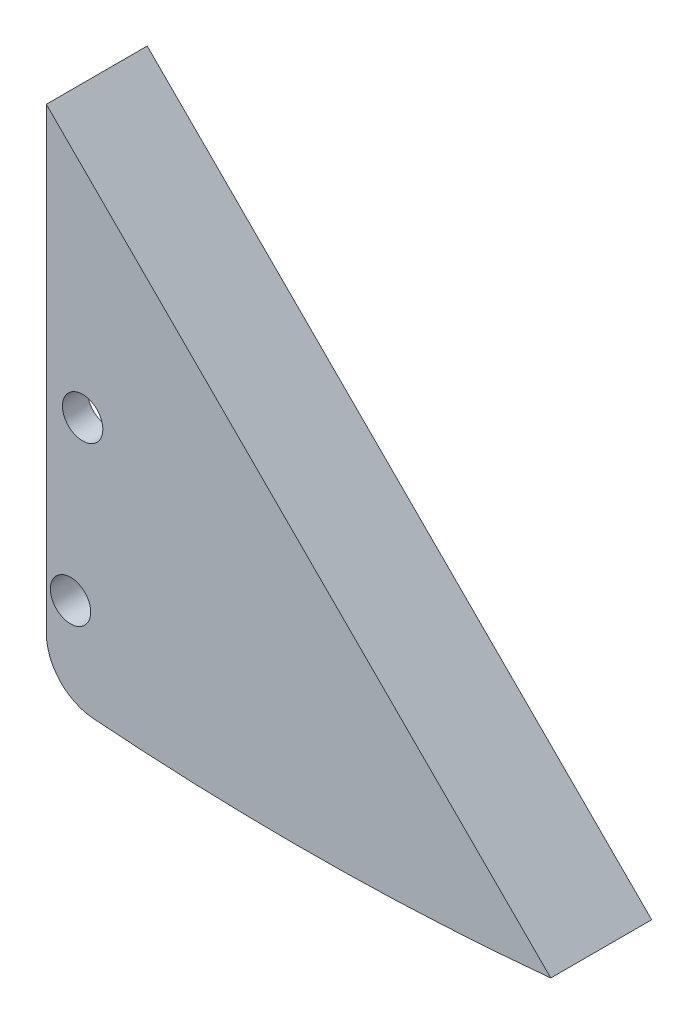
from build123d import *

# Parameters (mm, degrees)
SALIENTE_EXTRUIR1_DEPTH    = 5
CROQUIS3_R                 = 1
CORTAR_EXTRUIR1_DEPTH      = 5
REDONDEO2_R                = 2.5
CROQUIS4_W                 = 2.5
CROQUIS4_H                 = 9.3
CORTAR_EXTRUIR2_DEPTH      = 4.8
CORTAR_EXTRUIR3_DEPTH      = 37.123740235
CORTAR_EXTRUIR3_DEPTH_BACK = 37.123740235
CROQUIS5_R                 = 1


with BuildPart() as part:
    # Croquis2 → Saliente-Extruir1 (new body)
    with BuildSketch(Plane.XY):
        with BuildLine():
            Line((0, 0), (0, -25))
            add(Edge.make_bspline(
                [(0, -25), (12.595125448, -26.182989262), (25, -25)],
                knots=[0, 0, 0, 0.592275768, 0.592275768, 0.592275768], degree=2))
            Line((25, -25), (0, 0))
        make_face()
    extrude(amount=SALIENTE_EXTRUIR1_DEPTH)

    # Croquis3 → Cortar-Extruir1 (cut)
    with BuildSketch(Plane.XY.offset(5)):
        with Locations((1.2, -20.7)):
            Circle(CROQUIS3_R)
    extrude(amount=-CORTAR_EXTRUIR1_DEPTH, mode=Mode.SUBTRACT)

    # Redondeo2
    redondeo2_edges = [part.edges().sort_by_distance(p)[0] for p in [
        (0, -25, 2.5),
    ]]
    fillet(redondeo2_edges, radius=REDONDEO2_R)

    # Croquis4 → Cortar-Extruir2 (cut)
    with BuildSketch(Plane.ZY):
        with Locations((2.501199275, -12.55)):
            Rectangle(CROQUIS4_W, CROQUIS4_H)
    extrude(amount=-CORTAR_EXTRUIR2_DEPTH, mode=Mode.SUBTRACT)

    # Croquis5 → Cortar-Extruir3 (cut, two sides: drawn at the far end of the back side and taken through both)
    with BuildSketch(Plane.XY.offset(5).offset(-CORTAR_EXTRUIR3_DEPTH_BACK)):
        with Locations(Location((1.8, -12.55, 0), (0, 0, 270))):
            Circle(CROQUIS5_R)
    extrude(amount=CORTAR_EXTRUIR3_DEPTH + CORTAR_EXTRUIR3_DEPTH_BACK, mode=Mode.SUBTRACT)


solid = part.part
